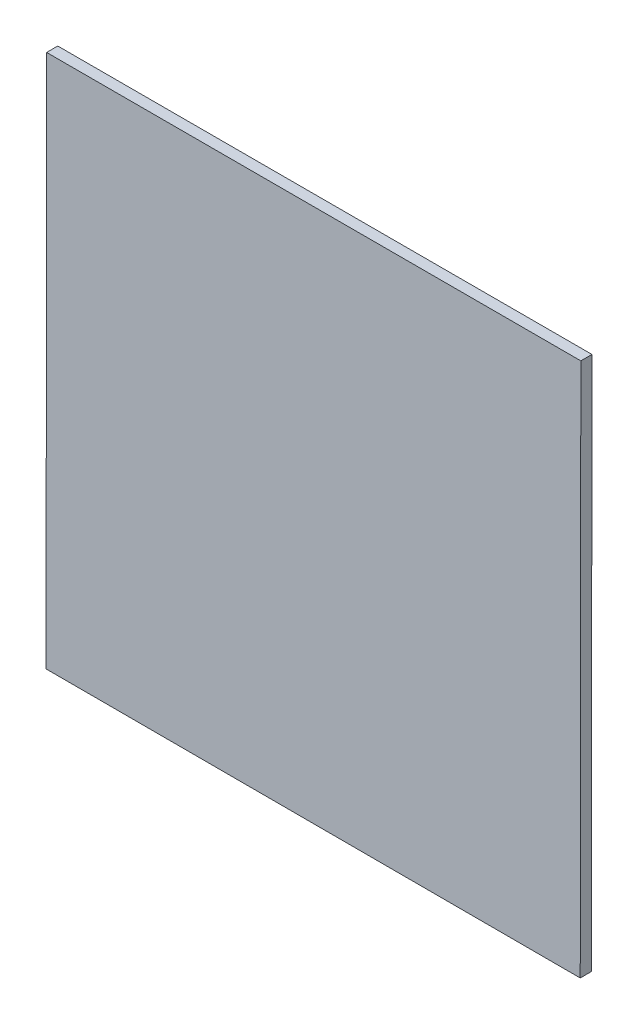
from build123d import *

# Parameters (mm, degrees)
BOSS_EXTRUDE1_DEPTH = 76.2


with BuildPart() as part:
    # Sketch1 → Boss-Extrude1 (new body)
    with BuildSketch(Plane.XY):
        Polygon((3573.483575236, 150.174047018), (-84.120794795, 150.174047018), (-88.118772752, -3507.425952982), (3569.481227248, -3511.42393094), align=None)
    extrude(amount=BOSS_EXTRUDE1_DEPTH)


solid = part.part
